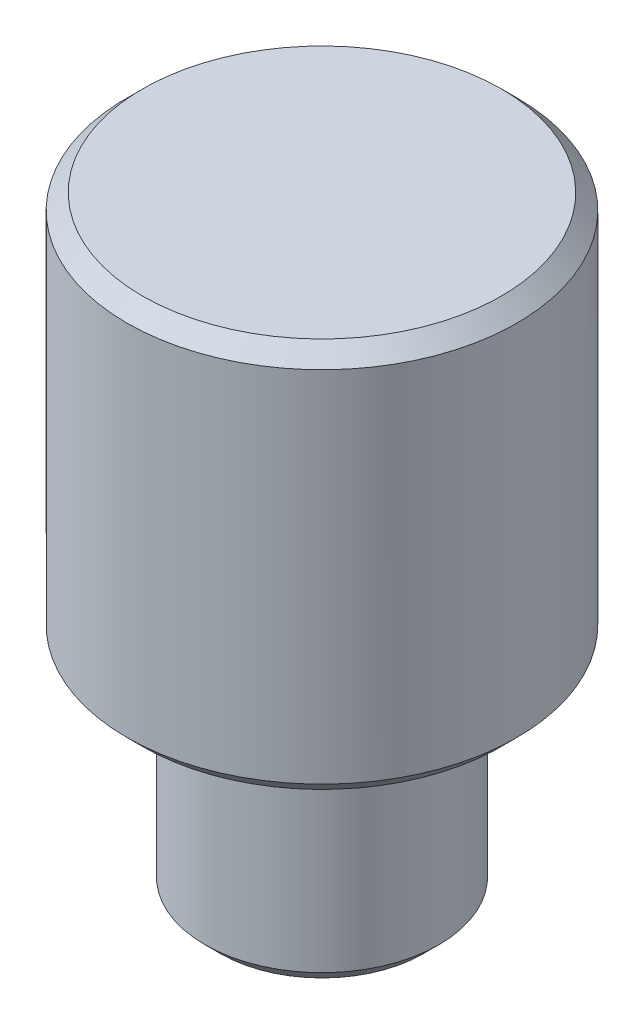
from build123d import *

# Parameters (mm, degrees)
CHAMFER1_SIZE = 2
CHAMFER2_SIZE = 2


with BuildPart() as part:
    # Sketch1 → Revolve1 (revolve)
    with BuildSketch(Plane.XY, mode=Mode.PRIVATE) as revolve1_sk:
        Polygon((0, 0), (25, 0), (25, -50), (15, -50), (15, -78), (0, -78), align=None)
    revolve(revolve1_sk.sketch.rotate(Axis((0, 0, 0), (0, -1, 0)), 90), axis=Axis((0, 0, 0), (0, -1, 0)))

    # Chamfer1
    chamfer1_edges = [part.edges().sort_by_distance(p)[0] for p in [
        (0, -78, -15),
    ]]
    chamfer(chamfer1_edges, length=CHAMFER1_SIZE)

    # Chamfer2
    chamfer2_edges = [part.edges().sort_by_distance(p)[0] for p in [
        (0, -50, -25),
        (0, 0, -25),
    ]]
    chamfer(chamfer2_edges, length=CHAMFER2_SIZE)


solid = part.part
